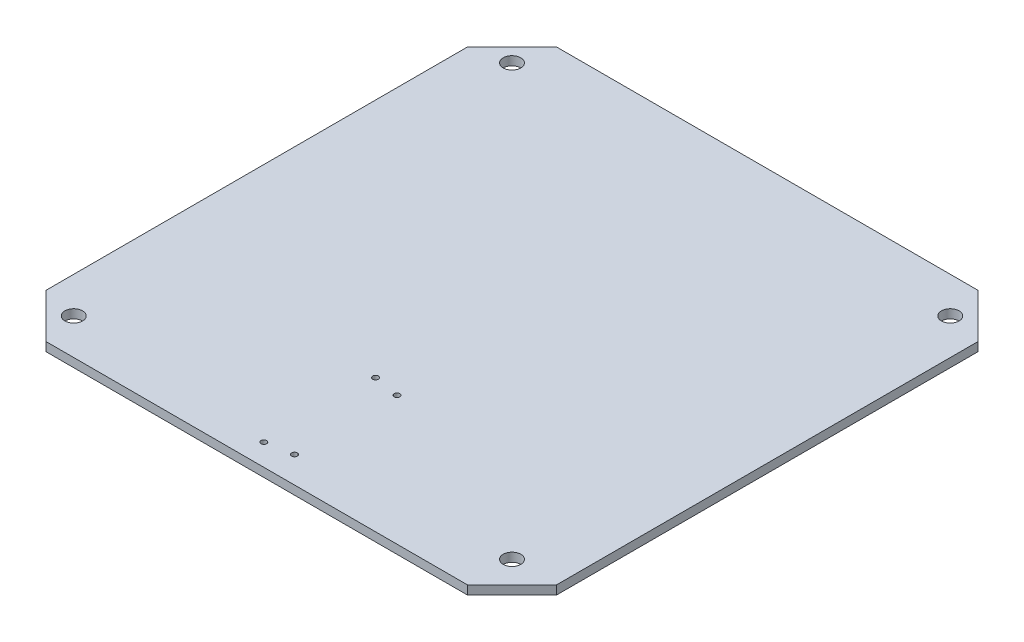
from build123d import *

# Parameters (mm, degrees)
BOSS_EXTRUDE1_DEPTH = 1.59
SKETCH2_R           = 1.59
SKETCH2_R_2         = 0.51
CUT_EXTRUDE1_DEPTH  = 1.59


with BuildPart() as part:
    # Sketch1 → Boss-Extrude1 (new body)
    with BuildSketch(Plane(origin=(0, 0, 0), x_dir=(1, 0, 0), z_dir=(0, 1, 0))):
        Polygon((-46, 38), (-38, 46), (38, 46), (46, 38), (46, -38), (38, -46), (-38, -46), (-46, -38), align=None)
    extrude(amount=BOSS_EXTRUDE1_DEPTH)

    # Sketch2 → Cut-Extrude1 (cut)
    with BuildSketch(Plane(origin=(0, 1.59, 0), x_dir=(1, 0, 0), z_dir=(0, 1, 0))):
        with Locations(Location((-39.5, 39.5, 0), (0, 0, 270))):
            Circle(SKETCH2_R)
        with Locations(Location((39.5, 39.5, 0), (0, 0, 270))):
            Circle(SKETCH2_R)
        with Locations(Location((38, -38, 0), (0, 0, 270))):
            Circle(SKETCH2_R)
        with Locations(Location((-39.5, -39.5, 0), (0, 0, 270))):
            Circle(SKETCH2_R)
        with Locations(Location((-2.67, -21.93, 0), (0, 0, 270))):
            Circle(SKETCH2_R_2)
        with Locations(Location((2.03, -22.75, 0), (0, 0, 270))):
            Circle(SKETCH2_R_2)
        with Locations(Location((-2.67, -42.07, 0), (0, 0, 270))):
            Circle(SKETCH2_R_2)
        with Locations(Location((2.03, -41.24, 0), (0, 0, 270))):
            Circle(SKETCH2_R_2)
    extrude(amount=-CUT_EXTRUDE1_DEPTH, mode=Mode.SUBTRACT)


solid = part.part
